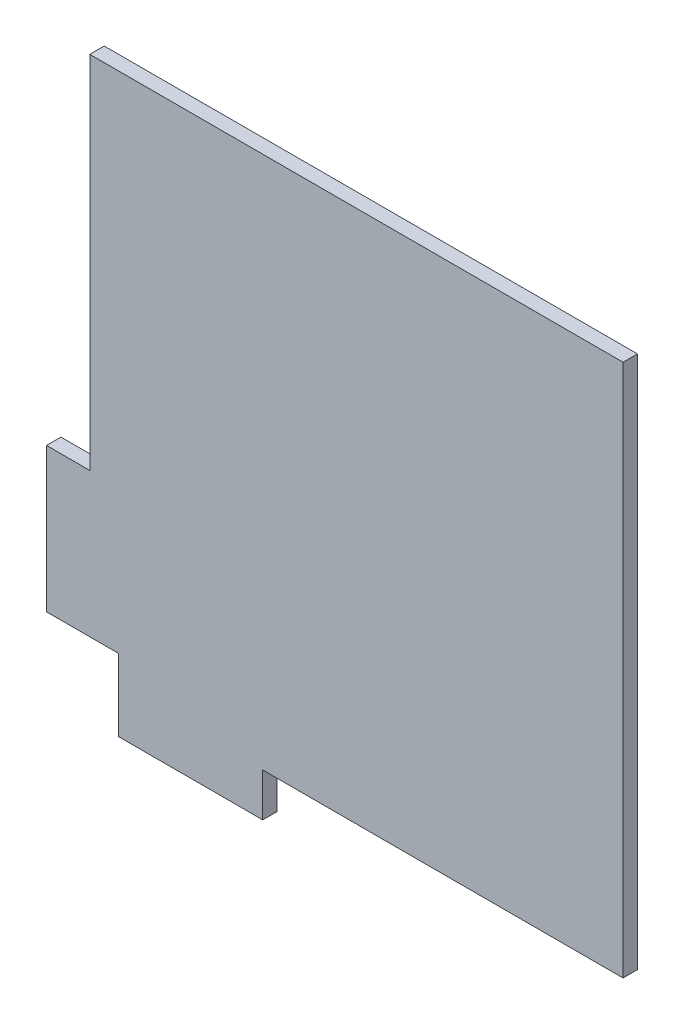
from build123d import *

# Parameters (mm, degrees)
BOSS_EXTRUDE1_DEPTH = 0.05


with BuildPart() as part:
    # Sketch1 → Boss-Extrude1 (new, symmetric)
    with BuildSketch(Plane.XY):
        Polygon((0, 0), (0, 3.7), (-3.7, 3.7), (-3.7, 1.2), (-4, 1.2), (-4, 0.2), (-3.5, 0.2), (-3.5, -0.3), (-2.5, -0.3), (-2.5, 0), align=None)
    extrude(amount=BOSS_EXTRUDE1_DEPTH, both=True)


solid = part.part
